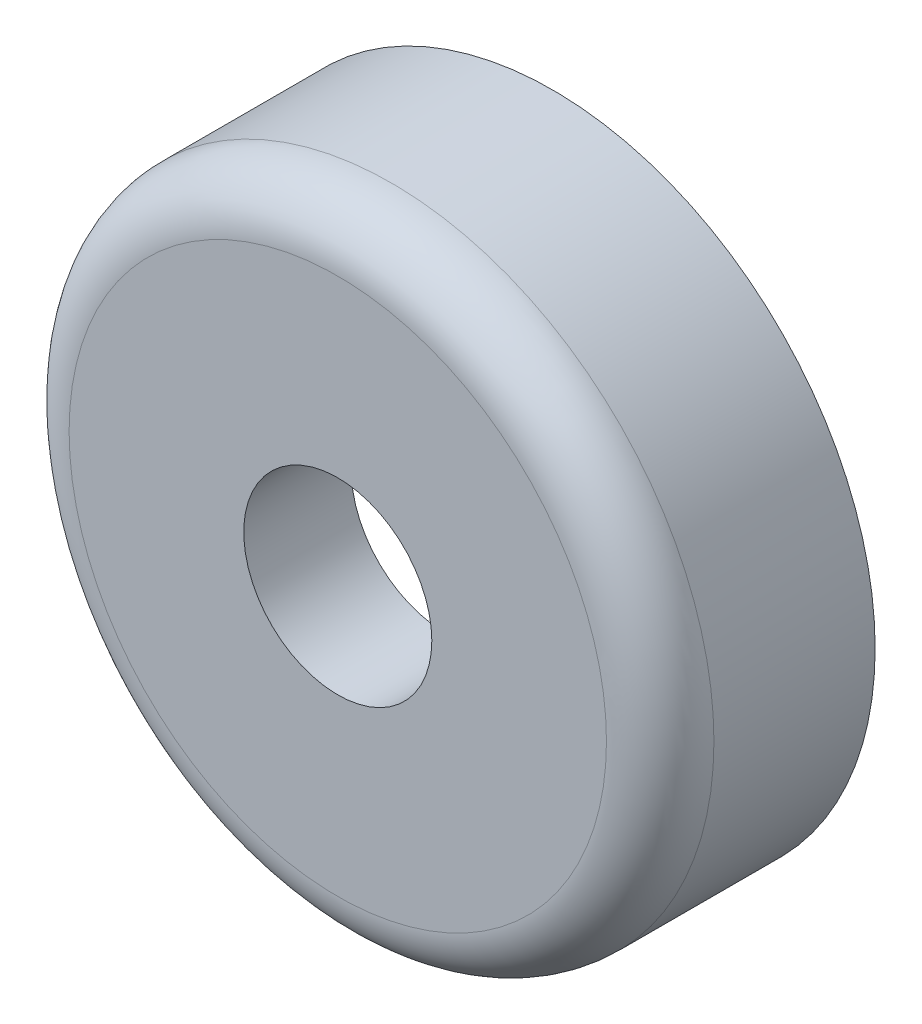
from build123d import *

# Parameters (mm, degrees)
SKETCH1_R           = 6
SKETCH1_R_2         = 4.1
BOSS_EXTRUDE1_DEPTH = 2
SKETCH2_R           = 6
SKETCH2_R_2         = 1.75
BOSS_EXTRUDE2_DEPTH = 2
FILLET1_R           = 1


with BuildPart() as part:
    # Sketch1 → Boss-Extrude1 (new body)
    with BuildSketch(Plane.XY):
        Circle(SKETCH1_R)
        Circle(SKETCH1_R_2, mode=Mode.SUBTRACT)
    extrude(amount=BOSS_EXTRUDE1_DEPTH)

    # Sketch2 → Boss-Extrude2 (add)
    with BuildSketch(Plane.XY.offset(2)):
        Circle(SKETCH2_R)
        Circle(SKETCH2_R_2, mode=Mode.SUBTRACT)
    extrude(amount=BOSS_EXTRUDE2_DEPTH)

    # Fillet1
    fillet1_edges = [part.edges().sort_by_distance(p)[0] for p in [
        (-6, 0, 4),
        (-4.1, 0, 0),
    ]]
    fillet(fillet1_edges, radius=FILLET1_R)


solid = part.part
